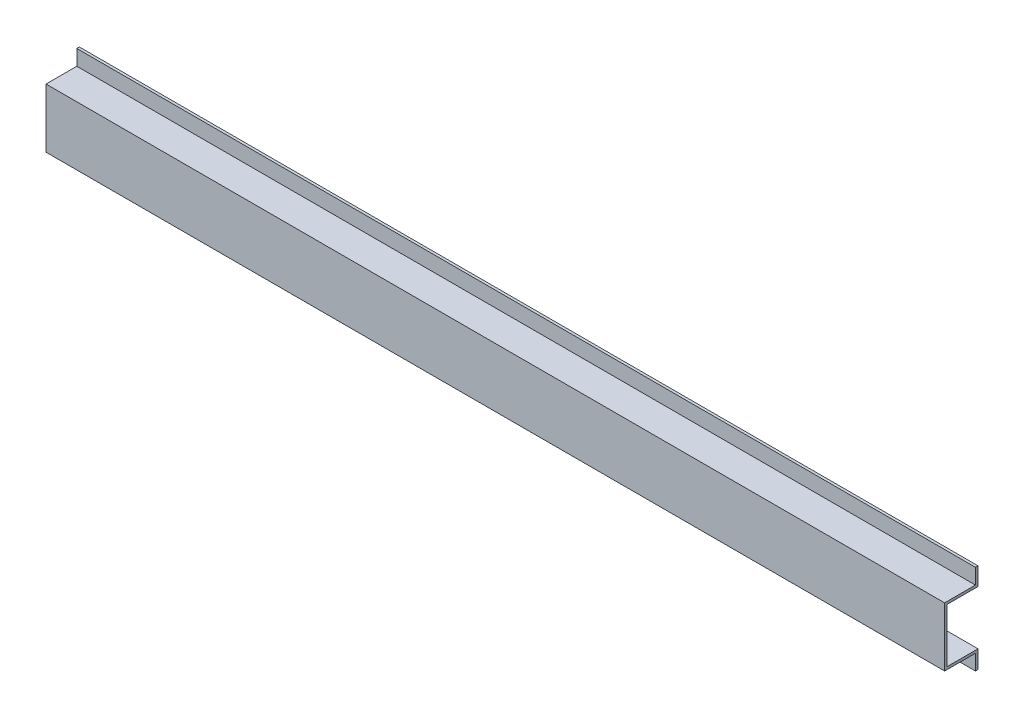
from build123d import *

# Parameters (mm, degrees)
SALIENTE_EXTRUIR1_DEPTH = 350


with BuildPart() as part:
    # Croquis1 → Saliente-Extruir1 (new body)
    with BuildSketch(Plane(origin=(0, 0, 0), x_dir=(0, 0, -1), z_dir=(1, 0, 0))):
        Polygon((0, 0), (0, -7), (-12, -7), (-12, -28), (0, -28), (0, -35), (-1, -35), (-1, -29), (-13, -29), (-13, -6), (-1, -6), (-1, 0), align=None)
    extrude(amount=SALIENTE_EXTRUIR1_DEPTH)


solid = part.part
